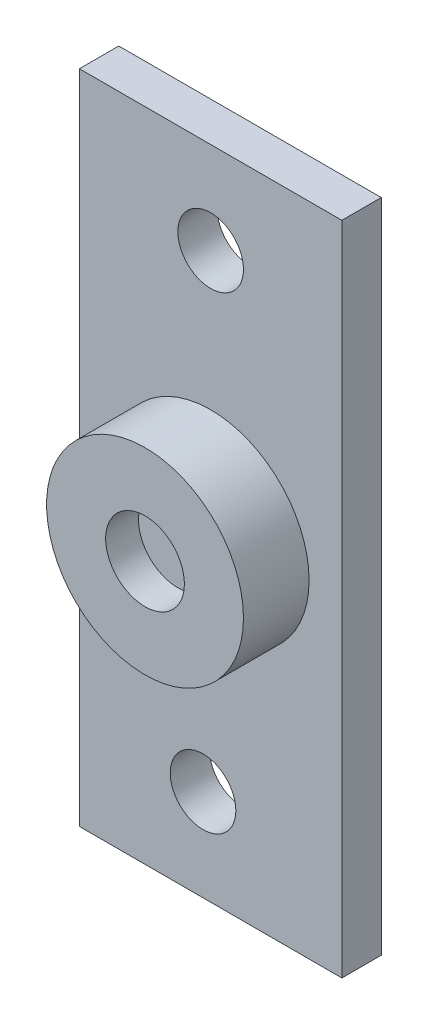
from build123d import *

# Parameters (mm, degrees)
SKETCH_1_W          = 20
SKETCH_1_H          = 50
EXTRUDE_1_DEPTH     = 3
SKETCH_2_R          = 7.5
EXTRUDE_2_DEPTH     = 5
SKETCH_3_R          = 3
CUT_EXTRUDE_1_DEPTH = 2.5
SKETCH_4_R          = 2.5
CUT_EXTRUDE_2_DEPTH = 3


with BuildPart() as part:
    # 草图1 → 凸台-拉伸1 (new body)
    with BuildSketch(Plane.XY):
        Rectangle(SKETCH_1_W, SKETCH_1_H)
    extrude(amount=EXTRUDE_1_DEPTH)

    # 草图2 → 凸台-拉伸2 (add)
    with BuildSketch(Plane.XY.offset(3)):
        Circle(SKETCH_2_R)
    extrude(amount=EXTRUDE_2_DEPTH)

    # 草图3 → 切除-拉伸1 (cut)
    with BuildSketch(Plane.XY.offset(8)):
        Circle(SKETCH_3_R)
    extrude(amount=-CUT_EXTRUDE_1_DEPTH, mode=Mode.SUBTRACT)

    # 草图4 → 切除-拉伸2 (cut)
    with BuildSketch(Plane.XY.offset(3)):
        with Locations((0, 18)):
            Circle(SKETCH_4_R)
        with Locations((-0.580661347, -18)):
            Circle(SKETCH_4_R)
    extrude(amount=-CUT_EXTRUDE_2_DEPTH, mode=Mode.SUBTRACT)


solid = part.part
